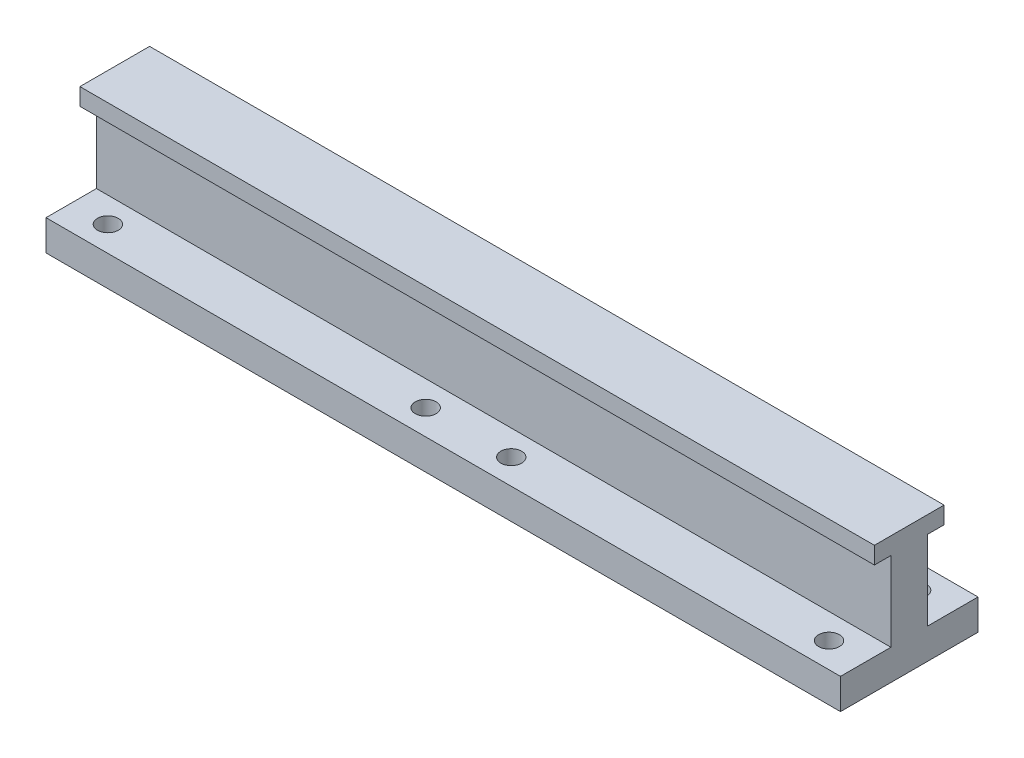
from build123d import *

# Parameters (mm, degrees)
SKETCH1_W           = 130
SKETCH1_H           = 5
BOSS_EXTRUDE1_DEPTH = 22.5
SKETCH3_W           = 3
SKETCH3_H           = 3
SKETCH3_H_2         = 10
BOSS_EXTRUDE2_DEPTH = 130
CUT_EXTRUDE1_REACH  = 134.875
SKETCH4_R           = 1.7


with BuildPart() as part:
    # Sketch1 → Boss-Extrude1 (new body)
    with BuildSketch(Plane.XY):
        with Locations((65, 2.5)):
            Rectangle(SKETCH1_W, SKETCH1_H)
    extrude(amount=BOSS_EXTRUDE1_DEPTH)

    # Sketch3 → Boss-Extrude2 (add)
    with BuildSketch(Plane.ZY):
        Polygon((11.25, 18), (14.25, 18), (16.95, 18), (16.95, 20.8), (11.25, 20.8), align=None)
        Polygon((8.25, 18), (11.25, 18), (11.25, 20.8), (5.55, 20.8), (5.55, 18), align=None)
        with Locations((9.75, 16.5)):
            Rectangle(SKETCH3_W, SKETCH3_H)
        with Locations((12.75, 16.5)):
            Rectangle(SKETCH3_W, SKETCH3_H)
        with Locations((12.75, 10)):
            Rectangle(SKETCH3_W, SKETCH3_H_2)
        with Locations((9.75, 10)):
            Rectangle(SKETCH3_W, SKETCH3_H_2)
    extrude(amount=-BOSS_EXTRUDE2_DEPTH)

    # Sketch4 → Cut-Extrude1 (cut, up to next)
    with BuildSketch(Plane(origin=(0, 5, 0), x_dir=(1, 0, 0), z_dir=(0, 1, 0)), mode=Mode.PRIVATE) as cut_extrude1_sk1:
        with Locations(Location((6, -18.375, 0), (0, 0, 270))):
            Circle(SKETCH4_R)
    cut_extrude1_tool1 = extrude(cut_extrude1_sk1.sketch, amount=-CUT_EXTRUDE1_REACH, mode=Mode.PRIVATE) & part.part
    # Sketch4 → Cut-Extrude1 (cut, up to next)
    with BuildSketch(Plane(origin=(0, 5, 0), x_dir=(1, 0, 0), z_dir=(0, 1, 0)), mode=Mode.PRIVATE) as cut_extrude1_sk2:
        with Locations(Location((58, -18.375, 0), (0, 0, 270))):
            Circle(SKETCH4_R)
    cut_extrude1_tool2 = extrude(cut_extrude1_sk2.sketch, amount=-CUT_EXTRUDE1_REACH, mode=Mode.PRIVATE) & part.part
    # Sketch4 → Cut-Extrude1 (cut, up to next)
    with BuildSketch(Plane(origin=(0, 5, 0), x_dir=(1, 0, 0), z_dir=(0, 1, 0)), mode=Mode.PRIVATE) as cut_extrude1_sk3:
        with Locations(Location((72, -18.375, 0), (0, 0, 270))):
            Circle(SKETCH4_R)
    cut_extrude1_tool3 = extrude(cut_extrude1_sk3.sketch, amount=-CUT_EXTRUDE1_REACH, mode=Mode.PRIVATE) & part.part
    # Sketch4 → Cut-Extrude1 (cut, up to next)
    with BuildSketch(Plane(origin=(0, 5, 0), x_dir=(1, 0, 0), z_dir=(0, 1, 0)), mode=Mode.PRIVATE) as cut_extrude1_sk4:
        with Locations(Location((124, -18.375, 0), (0, 0, 270))):
            Circle(SKETCH4_R)
    cut_extrude1_tool4 = extrude(cut_extrude1_sk4.sketch, amount=-CUT_EXTRUDE1_REACH, mode=Mode.PRIVATE) & part.part
    # Sketch4 → Cut-Extrude1 (cut, up to next)
    with BuildSketch(Plane(origin=(0, 5, 0), x_dir=(1, 0, 0), z_dir=(0, 1, 0)), mode=Mode.PRIVATE) as cut_extrude1_sk5:
        with Locations(Location((124, -4.125, 0), (0, 0, 270))):
            Circle(SKETCH4_R)
    cut_extrude1_tool5 = extrude(cut_extrude1_sk5.sketch, amount=-CUT_EXTRUDE1_REACH, mode=Mode.PRIVATE) & part.part
    # Sketch4 → Cut-Extrude1 (cut, up to next)
    with BuildSketch(Plane(origin=(0, 5, 0), x_dir=(1, 0, 0), z_dir=(0, 1, 0)), mode=Mode.PRIVATE) as cut_extrude1_sk6:
        with Locations(Location((72, -4.125, 0), (0, 0, 270))):
            Circle(SKETCH4_R)
    cut_extrude1_tool6 = extrude(cut_extrude1_sk6.sketch, amount=-CUT_EXTRUDE1_REACH, mode=Mode.PRIVATE) & part.part
    # Sketch4 → Cut-Extrude1 (cut, up to next)
    with BuildSketch(Plane(origin=(0, 5, 0), x_dir=(1, 0, 0), z_dir=(0, 1, 0)), mode=Mode.PRIVATE) as cut_extrude1_sk7:
        with Locations(Location((58, -4.125, 0), (0, 0, 270))):
            Circle(SKETCH4_R)
    cut_extrude1_tool7 = extrude(cut_extrude1_sk7.sketch, amount=-CUT_EXTRUDE1_REACH, mode=Mode.PRIVATE) & part.part
    # Sketch4 → Cut-Extrude1 (cut, up to next)
    with BuildSketch(Plane(origin=(0, 5, 0), x_dir=(1, 0, 0), z_dir=(0, 1, 0)), mode=Mode.PRIVATE) as cut_extrude1_sk8:
        with Locations(Location((6, -4.125, 0), (0, 0, 270))):
            Circle(SKETCH4_R)
    cut_extrude1_tool8 = extrude(cut_extrude1_sk8.sketch, amount=-CUT_EXTRUDE1_REACH, mode=Mode.PRIVATE) & part.part
    add(cut_extrude1_tool1.solids().sort_by_distance((6, 5, 18.375))[0], mode=Mode.SUBTRACT)
    add(cut_extrude1_tool2.solids().sort_by_distance((58, 5, 18.375))[0], mode=Mode.SUBTRACT)
    add(cut_extrude1_tool3.solids().sort_by_distance((72, 5, 18.375))[0], mode=Mode.SUBTRACT)
    add(cut_extrude1_tool4.solids().sort_by_distance((124, 5, 18.375))[0], mode=Mode.SUBTRACT)
    add(cut_extrude1_tool5.solids().sort_by_distance((124, 5, 4.125))[0], mode=Mode.SUBTRACT)
    add(cut_extrude1_tool6.solids().sort_by_distance((72, 5, 4.125))[0], mode=Mode.SUBTRACT)
    add(cut_extrude1_tool7.solids().sort_by_distance((58, 5, 4.125))[0], mode=Mode.SUBTRACT)
    add(cut_extrude1_tool8.solids().sort_by_distance((6, 5, 4.125))[0], mode=Mode.SUBTRACT)


solid = part.part
